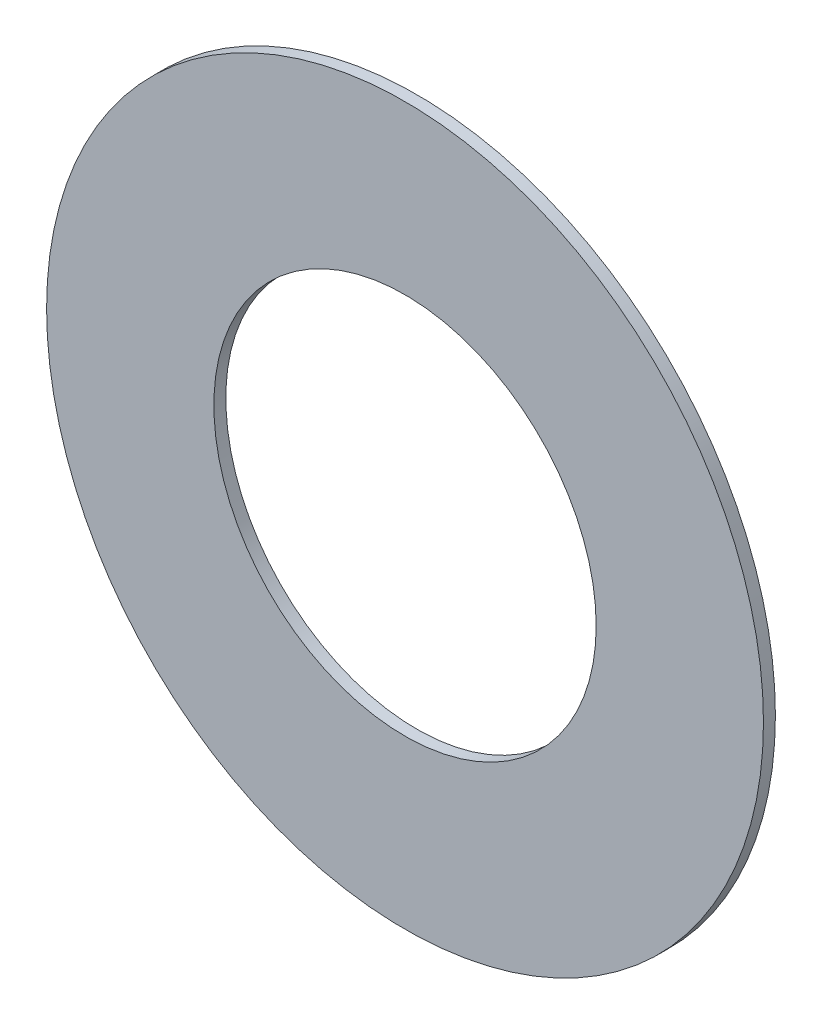
from build123d import *

# Parameters (mm, degrees)
SKETCH_1_R      = 60
EXTRUDE_1_DEPTH = 2
SHELL_5_T       = -28


with BuildPart() as part:
    # 草图1 → 凸台-拉伸1 (new body)
    with BuildSketch(Plane.XY):
        with Locations((-71.444705017, 26.318039667)):
            Circle(SKETCH_1_R)
    extrude(amount=EXTRUDE_1_DEPTH)

    # 抽壳5
    shell_5_openings = [part.faces().sort_by_distance(p)[0] for p in [
        (-71.444705017, 26.318039667, 2),
        (-71.444705017, 26.318039667, 0),
    ]]
    offset(amount=SHELL_5_T, openings=shell_5_openings, kind=Kind.INTERSECTION)


solid = part.part
